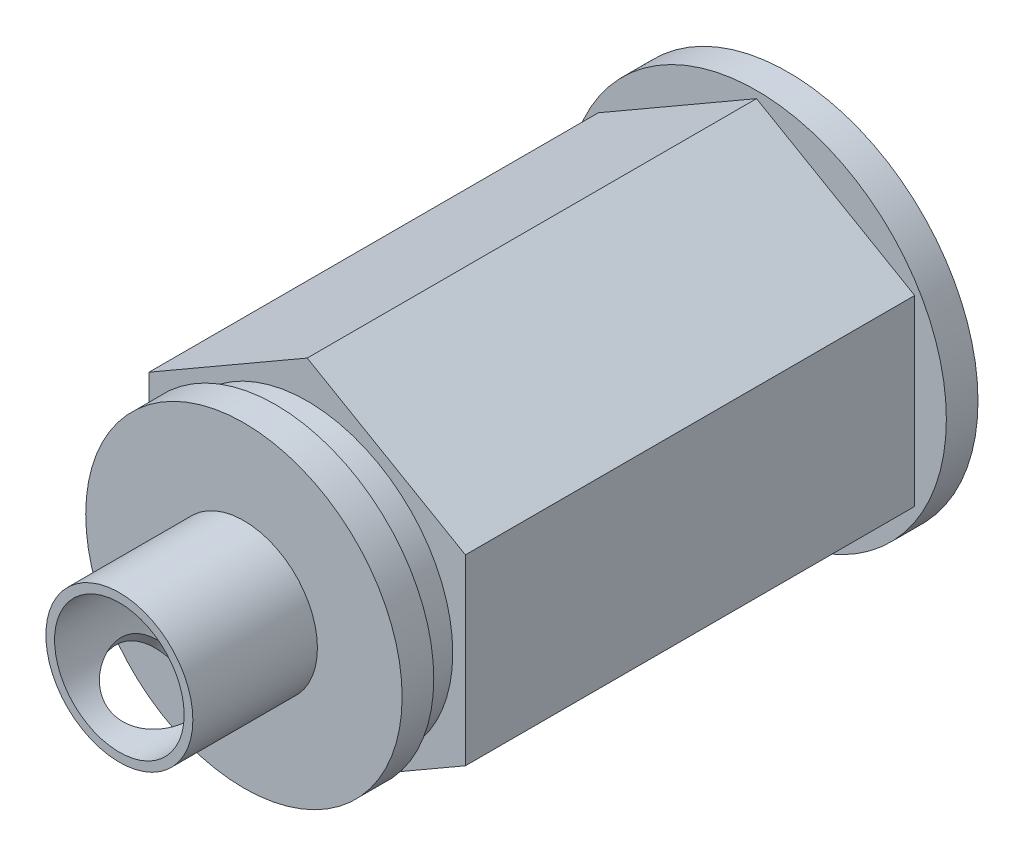
from build123d import *

# Parameters (mm, degrees)
BOSS_EXTRU_1_DEPTH      = 19.304
ESQUISSE2_R             = 7.62
BOSS_EXTRU_2_DEPTH      = 1.27
ESQUISSE3_R             = 5.842
BOSS_EXTRU_3_DEPTH      = 1.27
ESQUISSE4_R             = 6.35
BOSS_EXTRU_4_DEPTH      = 1.27
ESQUISSE5_R             = 2.525
ENL_V_MAT_EXTRU_1_DEPTH = 25.357527297
ESQUISSE7_R             = 2.95
ESQUISSE7_R_2           = 2.6
BOSS_EXTRU_6_DEPTH      = 5
ESQUISSE8_R             = 1.55
ENL_V_MAT_EXTRU_2_DEPTH = 5


with BuildPart() as part:
    # Esquisse1 → Boss.-Extru.1 (new body)
    with BuildSketch(Plane.XY):
        Polygon((0, 7.332348419), (-6.35, 3.666174209), (-6.35, -3.666174209), (0, -7.332348419), (6.35, -3.666174209), (6.35, 3.666174209), align=None)
    extrude(amount=BOSS_EXTRU_1_DEPTH)

    # Esquisse2 → Boss.-Extru.2 (add)
    with BuildSketch(Plane.XY):
        Circle(ESQUISSE2_R)
    extrude(amount=BOSS_EXTRU_2_DEPTH)

    # Esquisse3 → Boss.-Extru.3 (add)
    with BuildSketch(Plane.XY.offset(19.304)):
        Circle(ESQUISSE3_R)
    extrude(amount=BOSS_EXTRU_3_DEPTH)

    # Esquisse4 → Boss.-Extru.4 (add)
    with BuildSketch(Plane.XY.offset(20.574)):
        with Locations(Location((0, 0, 0), (0, 0, 180))):
            Circle(ESQUISSE4_R)
    extrude(amount=BOSS_EXTRU_4_DEPTH)

    # Esquisse5 → Enlèv. mat.-Extru.1 (cut, through all)
    with BuildSketch(Plane.XY):
        Circle(ESQUISSE5_R)
    extrude(amount=ENL_V_MAT_EXTRU_1_DEPTH, mode=Mode.SUBTRACT)

    # Esquisse7 → Boss.-Extru.6 (add)
    with BuildSketch(Plane.XY.offset(21.844)):
        Circle(ESQUISSE7_R)
        Circle(ESQUISSE7_R_2, mode=Mode.SUBTRACT)
    extrude(amount=BOSS_EXTRU_6_DEPTH)

    # Esquisse8 → Enlèv. mat.-Extru.2 (cut)
    with BuildSketch(Plane(origin=(-3.175, -5.499261314, 0), x_dir=(0.8660254037844417, -0.49999999999999495, 0), z_dir=(-0.49999999999999495, -0.8660254037844417, 0))):
        with Locations((0, 24.384)):
            Circle(ESQUISSE8_R)
    extrude(amount=-ENL_V_MAT_EXTRU_2_DEPTH, mode=Mode.SUBTRACT)


solid = part.part
